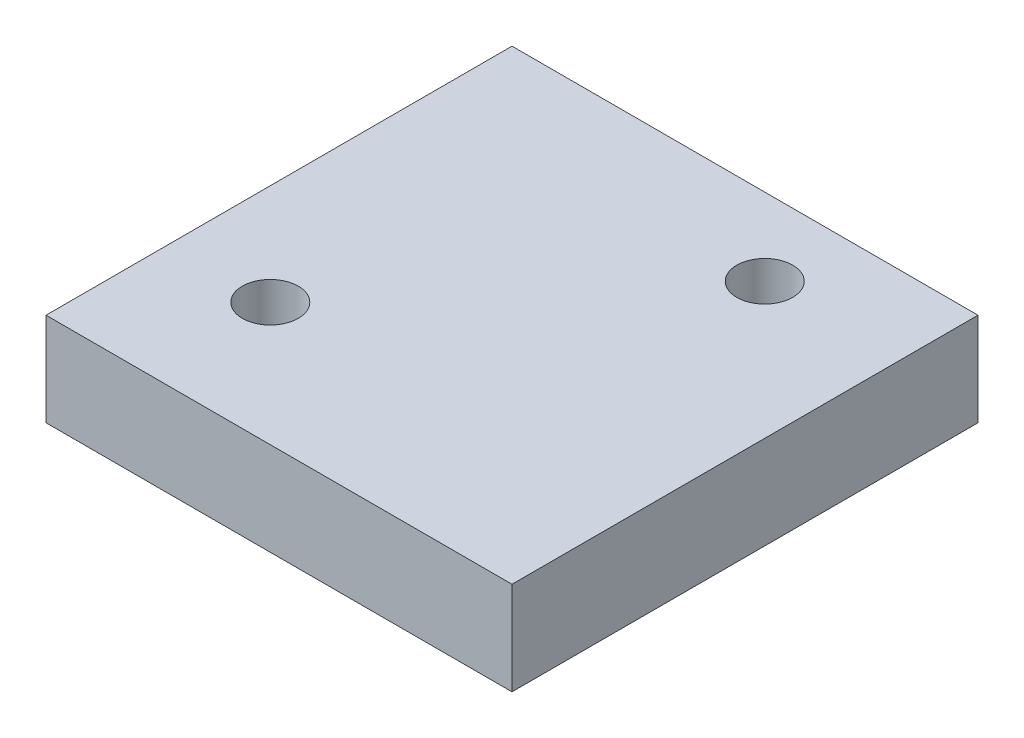
from build123d import *

# Parameters (mm, degrees)
SKETCH1_W                  = 100
SKETCH1_H                  = 100
BOSS_EXTRUDE1_DEPTH        = 20
F_12_0_12_DIAMETER_HOLE1_D = 12


with BuildPart() as part:
    # Sketch1 → Boss-Extrude1 (new body)
    with BuildSketch(Plane(origin=(0, 0, 0), x_dir=(1, 0, 0), z_dir=(0, 1, 0))):
        with Locations((50, 50)):
            Rectangle(SKETCH1_W, SKETCH1_H)
    extrude(amount=BOSS_EXTRUDE1_DEPTH)

    # Ø12.0 (12) Diameter Hole1 (through all)
    with Locations(Plane(origin=(0, 20, 0), x_dir=(1, 0, 0), z_dir=(0, 1, 0))):
        with Locations((21.660742505, 26.470495081), (70.814252342, 83.421073628)):
            Hole(F_12_0_12_DIAMETER_HOLE1_D / 2)


solid = part.part
